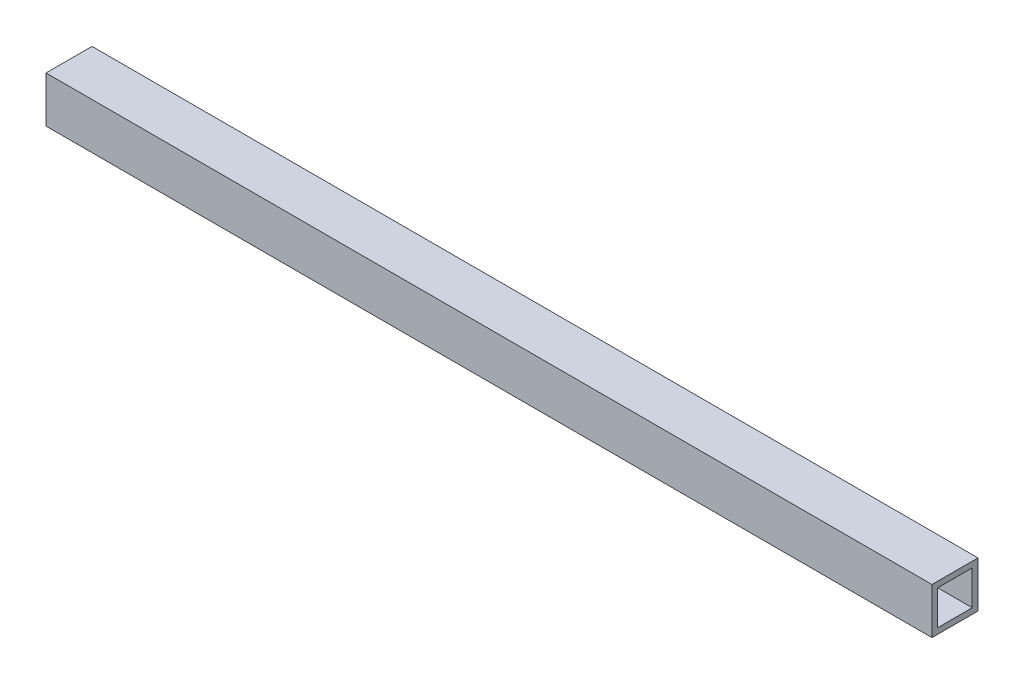
from build123d import *

# Parameters (mm, degrees)
SKETCH1_W           = 25.4
SKETCH1_H           = 25.4
SKETCH1_W_2         = 19.05
SKETCH1_H_2         = 19.05
BOSS_EXTRUDE1_DEPTH = 244.475


with BuildPart() as part:
    # Sketch1 → Boss-Extrude1 (new, symmetric)
    with BuildSketch(Plane(origin=(0, 0, 0), x_dir=(0, 0, -1), z_dir=(1, 0, 0))):
        Rectangle(SKETCH1_W, SKETCH1_H)
        Rectangle(SKETCH1_W_2, SKETCH1_H_2, mode=Mode.SUBTRACT)
    extrude(amount=BOSS_EXTRUDE1_DEPTH, both=True)


solid = part.part
